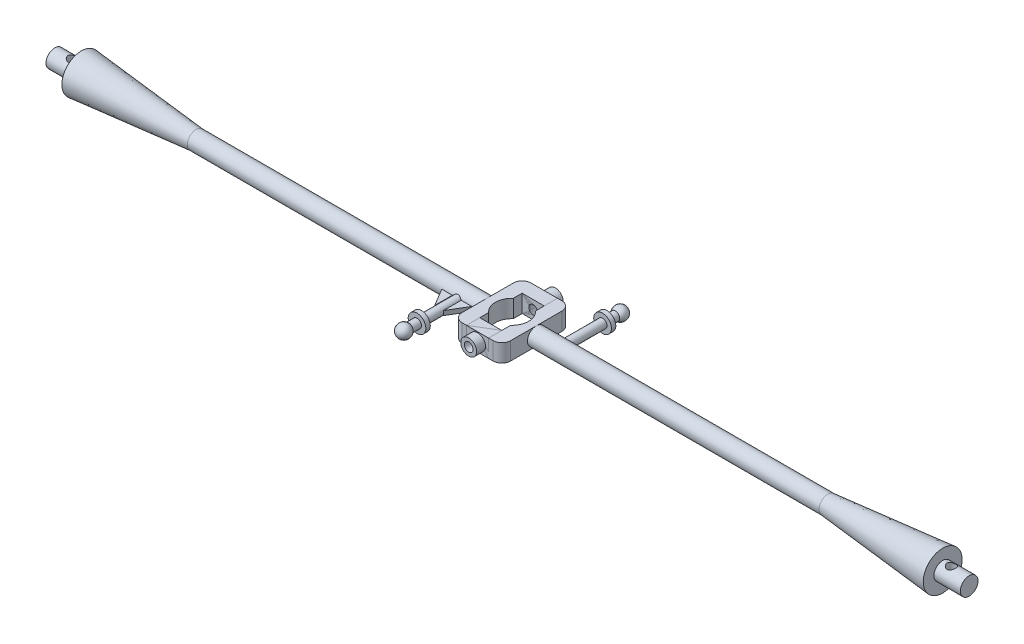
from build123d import *

# Parameters (mm, degrees)
BOSS_EXTRUDE1_DEPTH    = 1
FILLET1_R              = 1
SKETCH4_R              = 0.9
BOSS_EXTRUDE2_DEPTH    = 1
SKETCH5_R              = 0.5
CUT_EXTRUDE1_DEPTH     = 54.319086639
BOSS_EXTRUDE16_DEPTH   = 0.25
BOSS_EXTRUDE16_2_DEPTH = 0.25
BOSS_EXTRUDE16_3_DEPTH = 0.25
BOSS_EXTRUDE16_4_DEPTH = 0.25
SKETCH12_R             = 0.5
CUT_EXTRUDE2_DEPTH     = 5.25
CIRPATTERN1_COUNT      = 2
SKETCH13_R             = 1.875
CUT_EXTRUDE3_DEPTH     = 10


with BuildPart() as part:
    # Sketch1 → Boss-Extrude1 (new, symmetric)
    with BuildSketch(Plane(origin=(0, 0, 0), x_dir=(1, 0, 0), z_dir=(0, 1, 0))):
        Polygon((1.25, 3.9), (1.25, 2.4), (-1.25, 2.4), (-1.25, -2.4), (1.25, -2.4), (1.25, -3.9), (-2.75, -3.9), (-2.75, 3.9), align=None)
    extrude(amount=BOSS_EXTRUDE1_DEPTH, both=True)

    # Sketch2 → Revolve1 (revolve)
    with BuildSketch(Plane.XY):
        Polygon((-2.75, 0), (-35.75, 0), (-51.75, 0), (-51.75, 1), (-48.75, 1), (-48.75, 2.2), (-35.75, 1), (-2.75, 1), align=None)
    revolve(axis=Axis((-2.75, 0, 0), (-1, 0, 0)))

    # Sketch3 → Revolve2 (revolve)
    with BuildSketch(Plane(origin=(0, 0, 0), x_dir=(1, 0, 0), z_dir=(0, 1, 0))):
        with BuildLine():
            Line((-5.25, 0), (-5.25, -7.75))
            ThreePointArc((-5.25, -7.75), (-4.549370731, -7.267616567), (-4.75, -6.440983006))
            Line((-4.75, -6.440983006), (-4.75, -5.5))
            Line((-4.75, -5.5), (-4.25, -5.5))
            Line((-4.25, -5.5), (-4.25, -5))
            Line((-4.25, -5), (-4.75, -5))
            Line((-4.75, -5), (-4.75, 0))
            Line((-4.75, 0), (-5.25, 0))
        make_face()
    revolve(axis=Axis((-5.25, 0, 0), (0, 0, 1)))

    # Fillet1
    fillet1_edges = [part.edges().sort_by_distance(p)[0] for p in [
        (-2.75, 0, -3.9),
        (-2.75, 0, 3.9),
    ]]
    fillet(fillet1_edges, radius=FILLET1_R)

    # Sketch4 → Boss-Extrude2 (add, symmetric)
    with BuildSketch(Plane(origin=(0, 0, -3.9), x_dir=(-1, 0, 0), z_dir=(0, 0, -1))):
        Circle(SKETCH4_R)
    extrude(amount=BOSS_EXTRUDE2_DEPTH, both=True)

    # Sketch5 → Cut-Extrude1 (cut, through all)
    with BuildSketch(Plane(origin=(0, 0, -4.9), x_dir=(-1, 0, 0), z_dir=(0, 0, -1))):
        Circle(SKETCH5_R)
    extrude(amount=-CUT_EXTRUDE1_DEPTH, mode=Mode.SUBTRACT)

    # Sketch12 → Cut-Extrude2 (cut, symmetric)
    with BuildSketch(Plane(origin=(0, 0, 0), x_dir=(1, 0, 0), z_dir=(0, 1, 0))):
        with Locations((-49.75, 0)):
            Circle(SKETCH12_R)
    extrude(amount=CUT_EXTRUDE2_DEPTH, both=True, mode=Mode.SUBTRACT)


with BuildPart() as body_2:
    # Sketch10 → Boss-Extrude16 (new, symmetric)
    with BuildSketch(Plane(origin=(0, 0, 0), x_dir=(1, 0, 0), z_dir=(0, 1, 0))):
        Polygon((-5.75, -1), (-6.942772111, -1), (-5.75, -3), align=None)
    extrude(amount=BOSS_EXTRUDE16_DEPTH, both=True)


with BuildPart() as body_3:
    # Sketch10 → Boss-Extrude16 2 (new, symmetric)
    with BuildSketch(Plane(origin=(0, 0, 0), x_dir=(1, 0, 0), z_dir=(0, 1, 0))):
        Polygon((-4.75, -0.999976945), (-4.75, -2.999988473), (-3.557208561, -1), align=None)
    extrude(amount=BOSS_EXTRUDE16_2_DEPTH, both=True)


with BuildPart() as body_4:
    # Sketch10 → Boss-Extrude16 3 (new, symmetric)
    with BuildSketch(Plane(origin=(0, 0, 0), x_dir=(1, 0, 0), z_dir=(0, 1, 0))):
        Polygon((-2.75, -1), (-3.557208561, -1), (-2.75, -2.9), align=None)
    extrude(amount=BOSS_EXTRUDE16_3_DEPTH, both=True)


with BuildPart() as body_5:
    # Sketch10 → Boss-Extrude16 4 (new, symmetric)
    with BuildSketch(Plane(origin=(0, 0, 0), x_dir=(1, 0, 0), z_dir=(0, 1, 0))):
        Polygon((-2.75, 2.9), (-3.557227889, 1), (-2.75, 1), align=None)
    extrude(amount=BOSS_EXTRUDE16_4_DEPTH, both=True)


with BuildPart() as cirpattern1_1:
    # CirPattern1: pattern copy
    add(part.part.rotate(Axis((0, 2.42, 0), (0, -1, 0)), 1 * 360 / CIRPATTERN1_COUNT))


with BuildPart() as cut_extrude3_tool:
    # Sketch13 → Cut-Extrude3 (new body)
    with BuildSketch(Plane(origin=(0, 1, 0), x_dir=(1, 0, 0), z_dir=(0, 1, 0))):
        Circle(SKETCH13_R)
    extrude(amount=-CUT_EXTRUDE3_DEPTH)


with BuildPart() as part_1:
    add(part.part)

    # Cut-Extrude3: cut by cut_extrude3_tool
    add(cut_extrude3_tool.part, mode=Mode.SUBTRACT)


with BuildPart() as cirpattern1_1_1:
    add(cirpattern1_1.part)

    # Cut-Extrude3: cut by cut_extrude3_tool
    add(cut_extrude3_tool.part, mode=Mode.SUBTRACT)


solid = Compound([body_2.part, body_3.part, body_4.part, body_5.part, part_1.part, cirpattern1_1_1.part])
